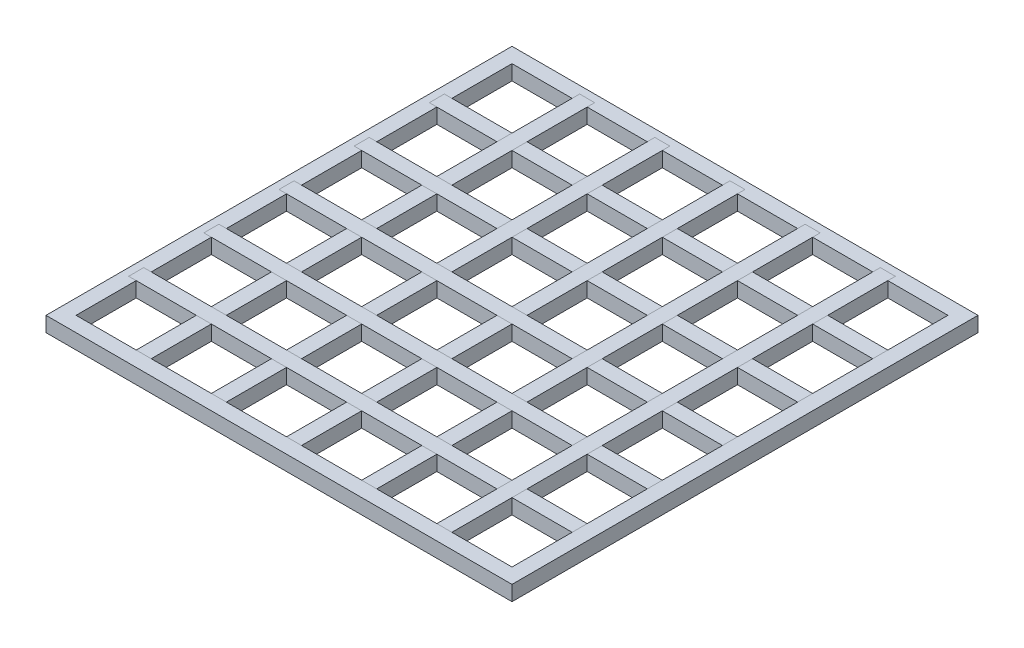
from build123d import *

# Parameters (mm, degrees)
SKETCH1_W              = 1
SKETCH1_H              = 30
EXTRUDE_THIN1_DEPTH    = 1
SKETCH1_W_2            = 31
SKETCH1_H_2            = 31
SKETCH1_W_3            = 29
SKETCH1_H_3            = 29
EXTRUDE_THIN1_2_DEPTH  = 1
EXTRUDE_THIN1_3_DEPTH  = 1
EXTRUDE_THIN1_4_DEPTH  = 1
EXTRUDE_THIN1_5_DEPTH  = 1
EXTRUDE_THIN1_6_DEPTH  = 1
SKETCH1_W_4            = 30
SKETCH1_H_4            = 1
EXTRUDE_THIN1_7_DEPTH  = 1
EXTRUDE_THIN1_8_DEPTH  = 1
EXTRUDE_THIN1_9_DEPTH  = 1
EXTRUDE_THIN1_10_DEPTH = 1
EXTRUDE_THIN1_11_DEPTH = 1


with BuildPart() as part:
    # Sketch1 → Extrude-Thin1 (new body)
    with BuildSketch(Plane(origin=(0, 0, 0), x_dir=(1, 0, 0), z_dir=(0, 1, 0))):
        with Locations((-10, 0)):
            Rectangle(SKETCH1_W, SKETCH1_H)
    extrude(amount=EXTRUDE_THIN1_DEPTH)


with BuildPart() as body_2:
    # Sketch1 → Extrude-Thin1 2 (new body)
    with BuildSketch(Plane(origin=(0, 0, 0), x_dir=(1, 0, 0), z_dir=(0, 1, 0))):
        Rectangle(SKETCH1_W_2, SKETCH1_H_2)
        Rectangle(SKETCH1_W_3, SKETCH1_H_3, mode=Mode.SUBTRACT)
    extrude(amount=EXTRUDE_THIN1_2_DEPTH)


with BuildPart() as body_3:
    # Sketch1 → Extrude-Thin1 3 (new body)
    with BuildSketch(Plane(origin=(0, 0, 0), x_dir=(1, 0, 0), z_dir=(0, 1, 0))):
        with Locations((-5, 0)):
            Rectangle(SKETCH1_W, SKETCH1_H)
    extrude(amount=EXTRUDE_THIN1_3_DEPTH)


with BuildPart() as body_4:
    # Sketch1 → Extrude-Thin1 4 (new body)
    with BuildSketch(Plane(origin=(0, 0, 0), x_dir=(1, 0, 0), z_dir=(0, 1, 0))):
        Rectangle(SKETCH1_W, SKETCH1_H)
    extrude(amount=EXTRUDE_THIN1_4_DEPTH)


with BuildPart() as body_5:
    # Sketch1 → Extrude-Thin1 5 (new body)
    with BuildSketch(Plane(origin=(0, 0, 0), x_dir=(1, 0, 0), z_dir=(0, 1, 0))):
        with Locations((5, 0)):
            Rectangle(SKETCH1_W, SKETCH1_H)
    extrude(amount=EXTRUDE_THIN1_5_DEPTH)


with BuildPart() as body_6:
    # Sketch1 → Extrude-Thin1 6 (new body)
    with BuildSketch(Plane(origin=(0, 0, 0), x_dir=(1, 0, 0), z_dir=(0, 1, 0))):
        with Locations((10, 0)):
            Rectangle(SKETCH1_W, SKETCH1_H)
    extrude(amount=EXTRUDE_THIN1_6_DEPTH)


with BuildPart() as body_7:
    # Sketch1 → Extrude-Thin1 7 (new body)
    with BuildSketch(Plane(origin=(0, 0, 0), x_dir=(1, 0, 0), z_dir=(0, 1, 0))):
        with Locations((0, -10)):
            Rectangle(SKETCH1_W_4, SKETCH1_H_4)
    extrude(amount=EXTRUDE_THIN1_7_DEPTH)


with BuildPart() as body_8:
    # Sketch1 → Extrude-Thin1 8 (new body)
    with BuildSketch(Plane(origin=(0, 0, 0), x_dir=(1, 0, 0), z_dir=(0, 1, 0))):
        with Locations((0, -5)):
            Rectangle(SKETCH1_W_4, SKETCH1_H_4)
    extrude(amount=EXTRUDE_THIN1_8_DEPTH)


with BuildPart() as body_9:
    # Sketch1 → Extrude-Thin1 9 (new body)
    with BuildSketch(Plane(origin=(0, 0, 0), x_dir=(1, 0, 0), z_dir=(0, 1, 0))):
        Rectangle(SKETCH1_W_4, SKETCH1_H_4)
    extrude(amount=EXTRUDE_THIN1_9_DEPTH)


with BuildPart() as body_10:
    # Sketch1 → Extrude-Thin1 10 (new body)
    with BuildSketch(Plane(origin=(0, 0, 0), x_dir=(1, 0, 0), z_dir=(0, 1, 0))):
        with Locations((0, 5)):
            Rectangle(SKETCH1_W_4, SKETCH1_H_4)
    extrude(amount=EXTRUDE_THIN1_10_DEPTH)


with BuildPart() as body_11:
    # Sketch1 → Extrude-Thin1 11 (new body)
    with BuildSketch(Plane(origin=(0, 0, 0), x_dir=(1, 0, 0), z_dir=(0, 1, 0))):
        with Locations((0, 10)):
            Rectangle(SKETCH1_W_4, SKETCH1_H_4)
    extrude(amount=EXTRUDE_THIN1_11_DEPTH)


solid = Compound([part.part, body_2.part, body_3.part, body_4.part, body_5.part, body_6.part, body_7.part, body_8.part, body_9.part, body_10.part, body_11.part])
